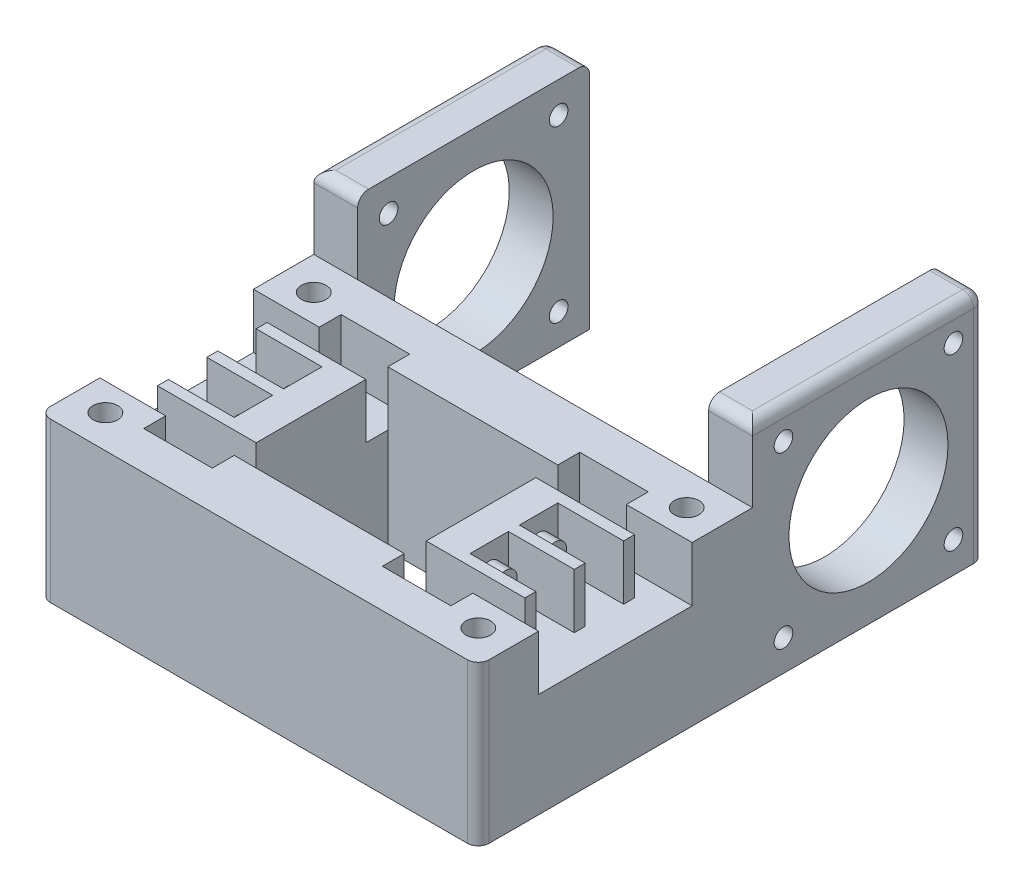
from build123d import *

# Parameters (mm, degrees)
SKETCH2_W            = 40
SKETCH2_H            = 50
BOSS_EXTRUDE1_DEPTH  = 29
CUT_EXTRUDE2_DEPTH   = 10
SKETCH6_R            = 2.085
BOSS_EXTRUDE2_DEPTH  = 3
CUT_EXTRUDE3_DEPTH   = 44.197222133
M4_CLEARANCE_HOLE2_D = 4.5
SKETCH2_3_W          = 8
SKETCH2_3_H          = 42.3
BOSS_EXTRUDE3_DEPTH  = 42.3
CUT_EXTRUDE4_REACH   = 90.986
SKETCH15_R           = 14.5
M3_CLEARANCE_HOLE1_D = 3.4
FILLET1_R            = 2
FILLET1_OF_MIRROR1_R = 2


with BuildPart() as part:
    # Sketch2 → Boss-Extrude1 (new body)
    with BuildSketch(Plane(origin=(0, 0, 0), x_dir=(1, 0, 0), z_dir=(0, 1, 0))):
        Rectangle(SKETCH2_W, SKETCH2_H)
    boss_extrude1 = extrude(amount=BOSS_EXTRUDE1_DEPTH)

    # Sketch3 → Cut-Extrude2 (cut)
    with BuildSketch(Plane(origin=(0, 29, 0), x_dir=(1, 0, 0), z_dir=(0, 1, 0))):
        Polygon((-8, 14), (-20, 14), (-20, -14), (-8, -14), (-8, -18), (4.5, -18), (4.5, -14), (4.5, -10), (-13.5, -10), (-13.5, -8), (-1.5, -8), (-1.5, -1), (-13.5, -1), (-13.5, 1), (-1.5, 1), (-1.5, 8), (-13.5, 8), (-13.5, 10), (4.5, 10), (4.5, 14), (4.5, 18), (-8, 18), align=None)
    cut_extrude2 = extrude(amount=-CUT_EXTRUDE2_DEPTH, mode=Mode.SUBTRACT)

    # Sketch6 → Boss-Extrude2 (add)
    with BuildSketch(Plane.ZY.offset(1.5)):
        with Locations((-4.5, 24)):
            Circle(SKETCH6_R)
        with Locations((4.5, 24)):
            Circle(SKETCH6_R)
    boss_extrude2 = extrude(amount=BOSS_EXTRUDE2_DEPTH)

    # Sketch3<4> → Cut-Extrude3 (cut, through all)
    with BuildSketch(Plane(origin=(0, 29, 0), x_dir=(1, 0, 0), z_dir=(0, 1, 0))):
        Polygon((20, -14), (20, 14), (4.5, 14), (4.5, 10), (4.5, -10), (4.5, -14), align=None)
    cut_extrude3 = extrude(amount=-CUT_EXTRUDE3_DEPTH, mode=Mode.SUBTRACT)

    # M4 Clearance Hole2 (through all)
    with Locations(Plane(origin=(0, 29, 0), x_dir=(1, 0, 0), z_dir=(0, 1, 0))):
        with Locations((-14, -19), (-14, 19)):
            m4_clearance_hole2 = Hole(M4_CLEARANCE_HOLE2_D / 2)

    # Sketch2<3> → Boss-Extrude3 (add)
    with BuildSketch(Plane(origin=(0, 0, 0), x_dir=(1, 0, 0), z_dir=(0, 1, 0))):
        with Locations((-16, 46.15)):
            Rectangle(SKETCH2_3_W, SKETCH2_3_H)
    boss_extrude3 = extrude(amount=BOSS_EXTRUDE3_DEPTH)

    # Sketch15 → Cut-Extrude4 (cut, up to next)
    with BuildSketch(Plane.ZY.offset(20), mode=Mode.PRIVATE) as cut_extrude4_sk1:
        with Locations((-46.15, 21.15)):
            Circle(SKETCH15_R)
    cut_extrude4_tool1 = extrude(cut_extrude4_sk1.sketch, amount=-CUT_EXTRUDE4_REACH, mode=Mode.PRIVATE) & part.part
    cut_extrude4 = cut_extrude4_tool1.solids().sort_by_distance((-20, 21.15, -46.15))[0]
    add(cut_extrude4, mode=Mode.SUBTRACT)

    # M3 Clearance Hole1 (through all)
    with Locations(Plane(origin=(-12, 0, 0), x_dir=(0, 0, 1), z_dir=(1, 0, 0))):
        with Locations((-61.65, -36.65), (-30.65, -36.65), (-61.65, -5.65), (-30.65, -5.65)):
            m3_clearance_hole1 = Hole(M3_CLEARANCE_HOLE1_D / 2)

    # Fillet1
    fillet1_edges = [part.edges().sort_by_distance(p)[0] for p in [
        (-16, 42.3, -67.3),
        (-20, 42.3, -46.15),
        (-20, 21.15, -67.3),
        (-16, 42.3, -25),
        (-20, 14.5, 25),
    ]]
    fillet(fillet1_edges, radius=FILLET1_R)

    # Mirror1: Boss-Extrude1, Cut-Extrude2, Boss-Extrude2, Cut-Extrude3, M4 Clearance Hole2, Boss-Extrude3, Cut-Extrude4, M3 Clearance Hole1 across plane
    add(boss_extrude1.mirror(Plane(origin=(20, 0, 0), x_dir=(0, 0, 1), z_dir=(1, 0, 0))))
    add(cut_extrude2.mirror(Plane(origin=(20, 0, 0), x_dir=(0, 0, 1), z_dir=(1, 0, 0))), mode=Mode.SUBTRACT)
    add(boss_extrude2.mirror(Plane(origin=(20, 0, 0), x_dir=(0, 0, 1), z_dir=(1, 0, 0))))
    add(cut_extrude3.mirror(Plane(origin=(20, 0, 0), x_dir=(0, 0, 1), z_dir=(1, 0, 0))), mode=Mode.SUBTRACT)
    add(m4_clearance_hole2.mirror(Plane(origin=(20, 0, 0), x_dir=(0, 0, 1), z_dir=(1, 0, 0))), mode=Mode.SUBTRACT)
    add(boss_extrude3.mirror(Plane(origin=(20, 0, 0), x_dir=(0, 0, 1), z_dir=(1, 0, 0))))
    add(cut_extrude4.mirror(Plane(origin=(20, 0, 0), x_dir=(0, 0, 1), z_dir=(1, 0, 0))), mode=Mode.SUBTRACT)
    add(m3_clearance_hole1.mirror(Plane(origin=(20, 0, 0), x_dir=(0, 0, 1), z_dir=(1, 0, 0))), mode=Mode.SUBTRACT)

    # Fillet1 of Mirror1
    fillet1_of_mirror1_edges = [part.edges().sort_by_distance(p)[0] for p in [
        (56, 42.3, -67.3),
        (60, 42.3, -46.15),
        (60, 21.15, -67.3),
        (56, 42.3, -25),
        (60, 14.5, 25),
    ]]
    fillet(fillet1_of_mirror1_edges, radius=FILLET1_OF_MIRROR1_R)


solid = part.part
